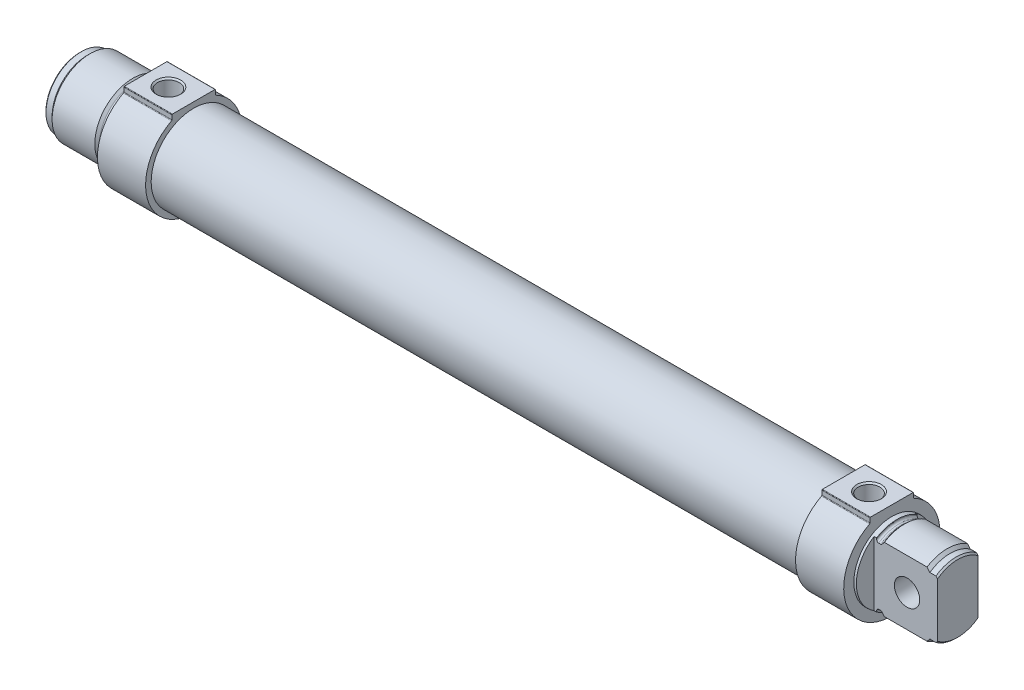
from build123d import *

# Parameters (mm, degrees)
BOSS_EXTRUDE1_DEPTH     = 19
SKETCH3_W               = 256.5
SKETCH3_H               = 16.8
BOSS_EXTRUDE2_DEPTH     = 19
CUT_EXTRUDE1_DEPTH      = 19
CUT_EXTRUDE1_DEPTH_BACK = 19
SKETCH7_W               = 16
SKETCH7_H               = 5
HOLE1_D                 = 8.566
HOLE1_DEPTH             = 8.5
HOLE1_CSINK_D           = 9.728
HOLE1_CSINK_ANGLE       = 90
HOLE2_D                 = 8.566
HOLE2_DEPTH             = 8.5
HOLE2_CSINK_D           = 9.728
HOLE2_CSINK_ANGLE       = 90


with BuildPart() as part:
    # Sketch1 → Revolve1 (revolve)
    with BuildSketch(Plane.XY):
        with BuildLine():
            Line((0, 0), (0, 13.3))
            Line((0, 13.3), (0.6, 13.9))
            Line((0.6, 13.9), (3, 13.9))
            Line((3, 13.9), (4.1, 15))
            Line((4.1, 15), (20.95, 15))
            Line((20.95, 15), (21.865685425, 14.084314575))
            ThreePointArc((21.865685425, 14.084314575), (22.125224104, 13.910896374), (22.43137085, 13.85))
            Line((22.43137085, 13.85), (23.2, 13.85))
            ThreePointArc((23.2, 13.85), (23.765685425, 14.084314575), (24, 14.65))
            Line((24, 14.65), (24, 15))
            Line((24, 15), (26, 15))
            Line((26, 15), (26, 0))
            Line((26, 0), (0, 0))
        make_face()
    revolve(axis=Axis((26, 0, 0), (-1, 0, 0)))

    # Sketch2 → Boss-Extrude1 (add)
    with BuildSketch(Plane(origin=(26, 0, 0), x_dir=(0, 0, -1), z_dir=(1, 0, 0))):
        with BuildLine():
            Line((8.6, 17.125419703), (8.6, 18.8))
            ThreePointArc((8.6, 18.8), (8.541421356, 18.941421356), (8.4, 19))
            Line((8.4, 19), (-8.4, 19))
            ThreePointArc((-8.4, 19), (-8.541421356, 18.941421356), (-8.6, 18.8))
            Line((-8.6, 18.8), (-8.6, 17.125419703))
            ThreePointArc((-8.6, 17.125419703), (-8.643579846, 16.969699747), (-8.761658031, 16.859221469))
            ThreePointArc((-8.761658031, 16.859221469), (0, -19), (8.761658031, 16.859221469))
            ThreePointArc((8.761658031, 16.859221469), (8.643579846, 16.969699747), (8.6, 17.125419703))
        make_face()
    extrude(amount=BOSS_EXTRUDE1_DEPTH)

    # Sketch3 → Revolve2 (revolve)
    with BuildSketch(Plane.XY):
        with Locations((173.25, 8.4)):
            Rectangle(SKETCH3_W, SKETCH3_H)
    revolve(axis=Axis((301.5, 0, 0), (-1, 0, 0)))

    # Sketch4 → Boss-Extrude2 (add)
    with BuildSketch(Plane(origin=(301.5, 0, 0), x_dir=(0, 0, -1), z_dir=(1, 0, 0))):
        with BuildLine():
            Line((8.6, 17.125419703), (8.6, 18.8))
            ThreePointArc((8.6, 18.8), (8.541421356, 18.941421356), (8.4, 19))
            Line((8.4, 19), (-8.4, 19))
            ThreePointArc((-8.4, 19), (-8.541421356, 18.941421356), (-8.6, 18.8))
            Line((-8.6, 18.8), (-8.6, 17.125419703))
            ThreePointArc((-8.6, 17.125419703), (-8.643579846, 16.969699747), (-8.761658031, 16.859221469))
            ThreePointArc((-8.761658031, 16.859221469), (0, -19), (8.761658031, 16.859221469))
            ThreePointArc((8.761658031, 16.859221469), (8.643579846, 16.969699747), (8.6, 17.125419703))
        make_face()
    extrude(amount=BOSS_EXTRUDE2_DEPTH)

    # Sketch5 → Revolve3 (revolve)
    with BuildSketch(Plane.XY):
        with BuildLine():
            Line((320.5, 0), (320.5, 15))
            Line((320.5, 15), (322.5, 15))
            Line((322.5, 15), (322.5, 14.65))
            ThreePointArc((322.5, 14.65), (322.734314575, 14.084314575), (323.3, 13.85))
            Line((323.3, 13.85), (324.06862915, 13.85))
            ThreePointArc((324.06862915, 13.85), (324.374775896, 13.910896374), (324.634314575, 14.084314575))
            Line((324.634314575, 14.084314575), (325.55, 15))
            Line((325.55, 15), (342.4, 15))
            Line((342.4, 15), (343.5, 13.9))
            Line((343.5, 13.9), (345.9, 13.9))
            Line((345.9, 13.9), (346.5, 13.3))
            Line((346.5, 13.3), (346.5, 0))
            Line((346.5, 0), (320.5, 0))
        make_face()
    revolve(axis=Axis((346.5, 0, 0), (-1, 0, 0)))

    # Sketch6 → Cut-Extrude1 (cut, two sides: drawn at the far end of the back side and taken through both)
    with BuildSketch(Plane(origin=(0, 0, 0), x_dir=(1, 0, 0), z_dir=(0, 1, 0)).offset(-CUT_EXTRUDE1_DEPTH_BACK)):
        Polygon((321.5, 24), (321.5, 8), (346.5, 8), (346.5, -8), (321.5, -8), (321.5, -24), (362.5, -24), (362.5, 24), align=None)
    extrude(amount=CUT_EXTRUDE1_DEPTH + CUT_EXTRUDE1_DEPTH_BACK, mode=Mode.SUBTRACT)

    # Sketch7 → Cut-Revolve1 (revolve, cut)
    with BuildSketch(Plane(origin=(334.5, 0, 0), x_dir=(0, 0, -1), z_dir=(1, 0, 0))):
        with Locations((0, 2.5)):
            Rectangle(SKETCH7_W, SKETCH7_H)
    revolve(axis=Axis((334.5, 0, -8), (0, 0, 1)), mode=Mode.SUBTRACT)

    # Hole1
    with Locations(Plane(origin=(0, 19, 0), x_dir=(1, 0, 0), z_dir=(0, 1, 0))):
        with Locations((35, 0)):
            CounterSinkHole(HOLE1_D / 2, HOLE1_CSINK_D / 2, depth=HOLE1_DEPTH, counter_sink_angle=HOLE1_CSINK_ANGLE)

    # Hole2
    with Locations(Plane(origin=(0, 19, 0), x_dir=(1, 0, 0), z_dir=(0, 1, 0))):
        with Locations((311.5, 0)):
            CounterSinkHole(HOLE2_D / 2, HOLE2_CSINK_D / 2, depth=HOLE2_DEPTH, counter_sink_angle=HOLE2_CSINK_ANGLE)

    # Sketch12 → Cut-Revolve2 (revolve, cut)
    with BuildSketch(Plane.XY):
        Polygon((-8, 0), (-8, 6), (57, 6), (57, 16), (290, 16), (290, 0), align=None)
    revolve(axis=Axis((290, 0, 0), (-1, 0, 0)), mode=Mode.SUBTRACT)


solid = part.part
